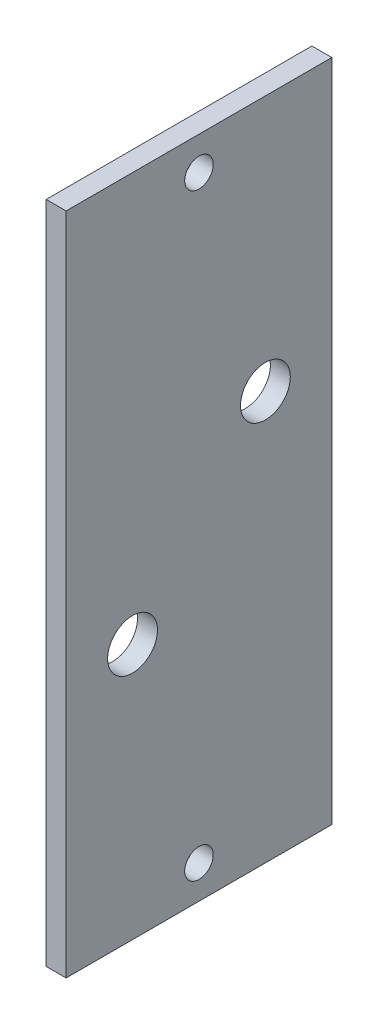
from build123d import *

# Parameters (mm, degrees)
SKETCH1_W           = 40
SKETCH1_H           = 100
SKETCH1_R           = 2.15
SKETCH1_R_2         = 3.75
BOSS_EXTRUDE2_DEPTH = 3


with BuildPart() as part:
    # Sketch1 → Boss-Extrude2 (new body)
    with BuildSketch(Plane(origin=(0, 0, 0), x_dir=(0, 0, -1), z_dir=(1, 0, 0))):
        with Locations((20, 50)):
            Rectangle(SKETCH1_W, SKETCH1_H)
        with Locations((20, 95)):
            Circle(SKETCH1_R, mode=Mode.SUBTRACT)
        with Locations((20, 5)):
            Circle(SKETCH1_R, mode=Mode.SUBTRACT)
        with Locations((10, 38.5)):
            Circle(SKETCH1_R_2, mode=Mode.SUBTRACT)
        with Locations((30, 61.5)):
            Circle(SKETCH1_R_2, mode=Mode.SUBTRACT)
    extrude(amount=BOSS_EXTRUDE2_DEPTH)


solid = part.part
